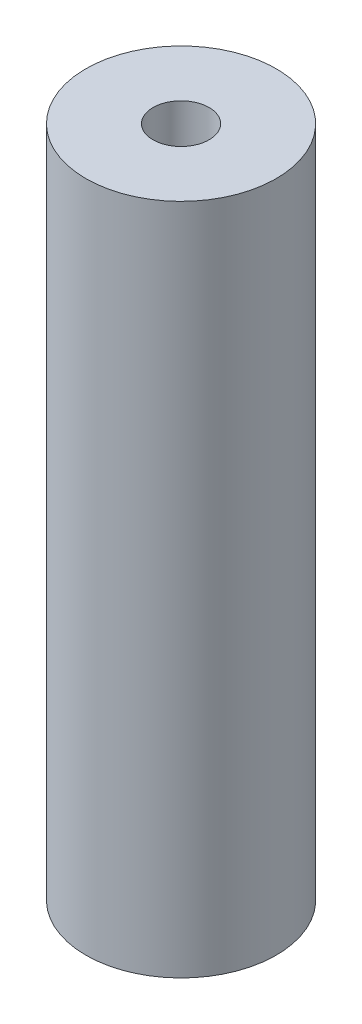
from build123d import *

# Parameters (mm, degrees)
SKETCH1_R           = 64.7065
SKETCH1_R_2         = 19.05
BOSS_EXTRUDE1_DEPTH = 457.2


with BuildPart() as part:
    # Sketch1 → Boss-Extrude1 (new body)
    with BuildSketch(Plane(origin=(0, 0, 0), x_dir=(1, 0, 0), z_dir=(0, 1, 0))):
        with Locations(Location((0, 0, 0), (0, 0, 270))):
            Circle(SKETCH1_R)
        with Locations(Location((0, 0, 0), (0, 0, 270))):
            Circle(SKETCH1_R_2, mode=Mode.SUBTRACT)
    extrude(amount=BOSS_EXTRUDE1_DEPTH)


solid = part.part
